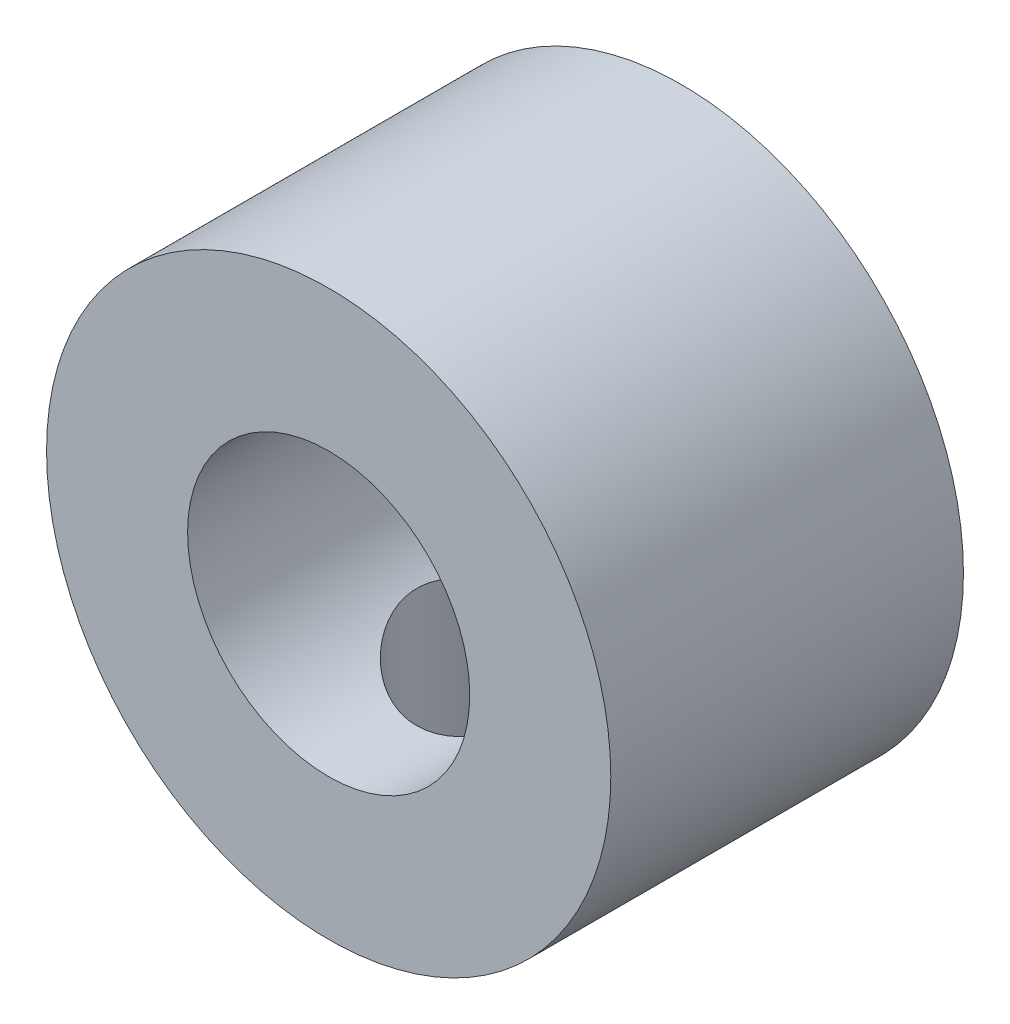
from build123d import *

# Parameters (mm, degrees)
ESQUISSE1_R             = 4.8
ESQUISSE1_R_2           = 2.4
BOSS_EXTRU_3_DEPTH      = 6
ESQUISSE6_R             = 1.5
ENL_V_MAT_EXTRU_1_DEPTH = 6


with BuildPart() as part:
    # Esquisse1 → Boss.-Extru.3 (new body)
    with BuildSketch(Plane.XY):
        Circle(ESQUISSE1_R)
        Circle(ESQUISSE1_R_2, mode=Mode.SUBTRACT)
    extrude(amount=BOSS_EXTRU_3_DEPTH)

    # Esquisse6 → Enlèv. mat.-Extru.1 (cut)
    with BuildSketch(Plane(origin=(0, 0, 0), x_dir=(1, 0, 0), z_dir=(0, 1, 0))):
        with Locations(Location((0, -3, 0), (0, 0, 270))):
            Circle(ESQUISSE6_R)
    extrude(amount=-ENL_V_MAT_EXTRU_1_DEPTH, mode=Mode.SUBTRACT)


solid = part.part
